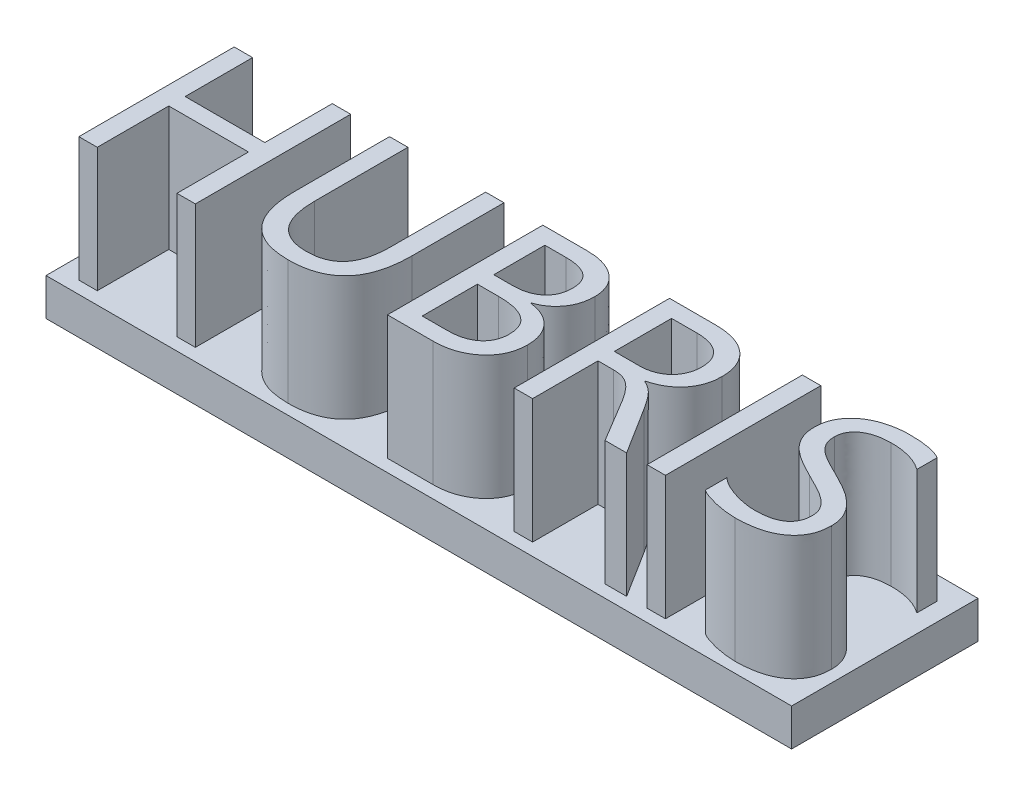
from build123d import *

# Parameters (mm, degrees)
SKETCH1_W           = 60
SKETCH1_H           = 15
BOSS_EXTRUDE1_DEPTH = 10
SKETCH2_W           = 1.480263158
SKETCH2_H           = 12.5
BOSS_EXTRUDE2_DEPTH = 10
SKETCH3_W           = 60
SKETCH3_H           = 15
CUT_EXTRUDE1_DEPTH  = 7


with BuildPart() as part:
    # Sketch1 → Boss-Extrude1 (new body)
    with BuildSketch(Plane(origin=(0, 0, 0), x_dir=(1, 0, 0), z_dir=(0, 1, 0))):
        Rectangle(SKETCH1_W, SKETCH1_H)
    extrude(amount=BOSS_EXTRUDE1_DEPTH)

    # Sketch2 → Boss-Extrude2 (add)
    # profile 1 of 6: a face of its own
    with BuildSketch(Plane(origin=(0, 10, 0), x_dir=(1, 0, 0), z_dir=(0, 1, 0))):
        Polygon((-18.980263158, -6.5), (-20.460526316, -6.5), (-20.460526316, -0.743421053), (-26.875, -0.743421053), (-26.875, -6.5), (-28.355263158, -6.5), (-28.355263158, 6), (-26.875, 6), (-26.875, 0.572368421), (-20.460526316, 0.572368421), (-20.460526316, 6), (-18.980263158, 6), align=None)
    # profile 2 of 6: a face of its own
    with BuildSketch(Plane(origin=(0, 10, 0), x_dir=(1, 0, 0), z_dir=(0, 1, 0))):
        with BuildLine():
            add(Edge.make_bspline(
                [(-6.644736842, -1.416735197), (-6.647662401, -1.628475672), (-6.653347072, -2.039909909), (-6.712175288, -2.635502205), (-6.799097733, -3.191168576), (-6.927496713, -3.705743773), (-7.094093187, -4.178825375), (-7.295069582, -4.613026174), (-7.533298394, -5.006461127), (-7.814589939, -5.354822739), (-8.126561468, -5.667677479), (-8.479356033, -5.935351244), (-8.867544713, -6.164331976), (-9.295579957, -6.344957328), (-9.757545703, -6.489758333), (-10.256136251, -6.590916958), (-10.790947414, -6.653723033), (-11.159870311, -6.660814598), (-11.350226151, -6.664473684)],
                knots=[0, 0, 0, 0, 1.257486394, 2.443429655, 3.551966457, 4.596153291, 5.589237736, 6.527229353, 7.434056241, 8.313863822, 9.181100807, 10.052374765, 10.937391783, 11.851514648, 12.805982722, 13.809031214, 14.869509843, 16, 16, 16, 16], degree=3))
            add(Edge.make_bspline(
                [(-11.350226151, -6.664473684), (-11.532006355, -6.660585737), (-11.885433594, -6.653026572), (-12.397812284, -6.592984237), (-12.876026498, -6.497443108), (-13.317940358, -6.358339799), (-13.724710413, -6.180085326), (-14.098333114, -5.964455082), (-14.434281149, -5.704232693), (-14.737439568, -5.408298765), (-15.00163825, -5.069268087), (-15.229994153, -4.691637024), (-15.42735099, -4.275761732), (-15.581646084, -3.817749807), (-15.704518822, -3.322590794), (-15.794658373, -2.78927663), (-15.844877572, -2.216090576), (-15.851726009, -1.821163422), (-15.855263158, -1.6171875)],
                knots=[0, 0, 0, 0, 1.124998465, 2.18728494, 3.188788596, 4.139710465, 5.0491097, 5.933139638, 6.802867158, 7.672820972, 8.549055192, 9.455775778, 10.399871767, 11.392647341, 12.442123967, 13.555388327, 14.737382537, 16, 16, 16, 16], degree=3))
            Line((-15.855263158, -1.6171875), (-15.855263158, 6))
            Line((-15.855263158, 6), (-14.375, 6))
            Line((-14.375, 6), (-14.375, -1.51953125))
            add(Edge.make_bspline(
                [(-14.375, -1.51953125), (-14.372310026, -1.673770728), (-14.36708679, -1.973263952), (-14.333274231, -2.408183666), (-14.266524904, -2.812631359), (-14.185617608, -3.189698078), (-14.071196546, -3.53488368), (-13.935126371, -3.851334232), (-13.774610552, -4.13843132), (-13.583105271, -4.391891537), (-13.374039595, -4.621088298), (-13.133787228, -4.814073864), (-12.872133683, -4.980425277), (-12.584985957, -5.117235859), (-12.271695909, -5.222460755), (-11.933871693, -5.296024601), (-11.571534778, -5.339884621), (-11.322082889, -5.345690581), (-11.193462171, -5.348684211)],
                knots=[0, 0, 0, 0, 1.299654722, 2.523593756, 3.671020551, 4.751360587, 5.769312404, 6.729351094, 7.65053966, 8.532525331, 9.400670288, 10.257368935, 11.120368259, 12.008152559, 12.930245471, 13.898631188, 14.916506242, 16, 16, 16, 16], degree=3))
            add(Edge.make_bspline(
                [(-11.193462171, -5.348684211), (-11.069169819, -5.345346138), (-10.828446729, -5.338881129), (-10.47831069, -5.299840696), (-10.154554344, -5.223679521), (-9.851863882, -5.124492426), (-9.574964016, -4.992599142), (-9.319031159, -4.836114888), (-9.091055132, -4.644641631), (-8.885155686, -4.427434656), (-8.706389582, -4.178054419), (-8.549018462, -3.90309122), (-8.418769419, -3.597168921), (-8.310780947, -3.263449887), (-8.22623267, -2.900734406), (-8.168919449, -2.508710158), (-8.132289603, -2.089029446), (-8.127479589, -1.799731148), (-8.125, -1.650596217)],
                knots=[0, 0, 0, 0, 1.085199783, 2.101759598, 3.068587945, 3.983717579, 4.876829924, 5.740014781, 6.594998481, 7.467846156, 8.345835695, 9.26684283, 10.228102979, 11.242570425, 12.325423214, 13.474977889, 14.698336626, 16, 16, 16, 16], degree=3))
            Line((-8.125, -1.650596217), (-8.125, 6))
            Line((-8.125, 6), (-6.644736842, 6))
            Line((-6.644736842, 6), (-6.644736842, -1.416735197))
        make_face()
    # profile 3 of 6: a face of its own
    with BuildSketch(Plane(origin=(0, 10, 0), x_dir=(1, 0, 0), z_dir=(0, 1, 0))):
        with BuildLine():
            Line((-3.519736842, -6.5), (-3.519736842, 6))
            Line((-3.519736842, 6), (0.034436678, 6))
            add(Edge.make_bspline(
                [(0.034436678, 6), (0.165561631, 5.997294329), (0.422319237, 5.991996316), (0.797354018, 5.957661301), (1.150871866, 5.891923868), (1.484228232, 5.805961321), (1.795381731, 5.69248087), (2.087260845, 5.55581981), (2.356421261, 5.391333888), (2.603817873, 5.202937209), (2.826824773, 4.996317211), (3.021752371, 4.771890401), (3.182811865, 4.530148777), (3.323300194, 4.277988492), (3.423595576, 4.005874795), (3.50011382, 3.720589466), (3.543276837, 3.419416968), (3.549479623, 3.2134987), (3.552631579, 3.10886102)],
                knots=[0, 0, 0, 0, 1.229187845, 2.406889916, 3.525113737, 4.596308509, 5.630135849, 6.625063885, 7.612446102, 8.580839693, 9.535318138, 10.457641659, 11.359607947, 12.254217275, 13.156433717, 14.069871481, 15.019202262, 16, 16, 16, 16], degree=3))
            add(Edge.make_bspline(
                [(3.552631579, 3.10886102), (3.551669824, 3.020532522), (3.549769093, 2.84596751), (3.519093927, 2.589481379), (3.477040745, 2.341719438), (3.414019381, 2.103090283), (3.335264554, 1.872413408), (3.237329482, 1.650503495), (3.120465111, 1.438676551), (2.987959319, 1.236168836), (2.837933766, 1.047288613), (2.678459973, 0.866770435), (2.501996844, 0.704391991), (2.312043414, 0.5556635), (2.108910139, 0.423645636), (1.894255398, 0.300116182), (1.663879941, 0.196023999), (1.503127001, 0.138667028), (1.422183388, 0.109786184)],
                knots=[0, 0, 0, 0, 1.073216213, 2.121014242, 3.136425385, 4.126687308, 5.118098756, 6.097345187, 7.07153834, 8.056583263, 9.035829693, 10.001972449, 10.98216001, 11.946785837, 12.93183076, 13.925264329, 14.955312402, 16, 16, 16, 16], degree=3))
            Line((1.422183388, 0.109786184), (1.422183388, 0.076377467))
            add(Edge.make_bspline(
                [(1.422183388, 0.076377467), (1.525323749, 0.062875582), (1.728044064, 0.036337896), (2.021120602, -0.035571512), (2.300121589, -0.121771391), (2.56290152, -0.229350778), (2.809012709, -0.359729174), (3.04075223, -0.507666599), (3.255173211, -0.679067543), (3.452266131, -0.86826338), (3.630842025, -1.075218467), (3.78815947, -1.296959775), (3.916262464, -1.537469562), (4.026430856, -1.789164381), (4.105982038, -2.058240946), (4.170977236, -2.340042366), (4.201684517, -2.63847796), (4.207543108, -2.84212763), (4.210526316, -2.94582648)],
                knots=[0, 0, 0, 0, 1.096402002, 2.154956183, 3.178015766, 4.174720488, 5.144733104, 6.112175251, 7.070332182, 8.035281626, 8.989853138, 9.94992532, 10.896034876, 11.859417808, 12.842597199, 13.851068742, 14.905759573, 16, 16, 16, 16], degree=3))
            add(Edge.make_bspline(
                [(4.210526316, -2.94582648), (4.207259903, -3.07537887), (4.20087031, -3.328802802), (4.145222963, -3.6991845), (4.056082616, -4.050157062), (3.92894504, -4.383359823), (3.763678932, -4.696411872), (3.564314683, -4.99318506), (3.326496341, -5.267648012), (3.05631246, -5.521689903), (2.7600373, -5.750990707), (2.442933713, -5.953997485), (2.103659797, -6.119779929), (1.748298448, -6.259782501), (1.373138854, -6.367975132), (0.979237433, -6.444108636), (0.565858792, -6.491686418), (0.283848648, -6.497189248), (0.139802632, -6.5)],
                knots=[0, 0, 0, 0, 1.026205522, 2.007412131, 2.960769465, 3.891227615, 4.826502666, 5.760421619, 6.718408566, 7.698110977, 8.694835934, 9.683599126, 10.676385999, 11.682407848, 12.707242684, 13.765703516, 14.85875911, 16, 16, 16, 16], degree=3))
            Line((0.139802632, -6.5), (-3.519736842, -6.5))
        make_face()
        with BuildLine():
            Line((-2.039473684, 4.684210526), (-2.039473684, 0.572368421))
            Line((-2.039473684, 0.572368421), (-0.528371711, 0.572368421))
            add(Edge.make_bspline(
                [(-0.528371711, 0.572368421), (-0.429807934, 0.574678498), (-0.238340149, 0.579166002), (0.041844566, 0.604304072), (0.306096871, 0.649431638), (0.553060074, 0.717276097), (0.783954422, 0.799226012), (0.999157898, 0.899309827), (1.197439387, 1.021109177), (1.379679881, 1.159052785), (1.543841301, 1.314105628), (1.684302291, 1.487204969), (1.807121121, 1.672970613), (1.905162003, 1.875244868), (1.979414536, 2.093050533), (2.032535706, 2.324733431), (2.067760622, 2.571536234), (2.070800785, 2.741236969), (2.072368421, 2.828741776)],
                knots=[0, 0, 0, 0, 1.212116198, 2.354629775, 3.456051241, 4.503724637, 5.499987713, 6.465998242, 7.416258802, 8.355892409, 9.272330463, 10.185432807, 11.091153343, 12.005105932, 12.941190166, 13.914695248, 14.924729524, 16, 16, 16, 16], degree=3))
            add(Edge.make_bspline(
                [(2.072368421, 2.828741776), (2.07031428, 2.903365358), (2.066308771, 3.048878948), (2.037606369, 3.259707562), (1.99217546, 3.457487761), (1.92502222, 3.6401622), (1.840057104, 3.808664546), (1.735869195, 3.96267361), (1.612095454, 4.101549047), (1.469487934, 4.225618075), (1.308426952, 4.334927584), (1.127032884, 4.426272806), (0.927656235, 4.506438476), (0.709342194, 4.572893608), (0.472053627, 4.623825744), (0.216960298, 4.659385695), (-0.056898958, 4.679476689), (-0.24564933, 4.682596065), (-0.343338816, 4.684210526)],
                knots=[0, 0, 0, 0, 1.029959442, 2.008387857, 2.93203746, 3.826220497, 4.688311486, 5.531290821, 6.385722972, 7.24902983, 8.134647622, 9.065536915, 10.047176225, 11.098371407, 12.211786757, 13.394221485, 14.651355428, 16, 16, 16, 16], degree=3))
            Line((-0.343338816, 4.684210526), (-2.039473684, 4.684210526))
        make_face(mode=Mode.SUBTRACT)
        with BuildLine():
            Line((-2.039473684, -0.743421053), (-2.039473684, -5.184210526))
            Line((-2.039473684, -5.184210526), (-0.022101151, -5.184210526))
            add(Edge.make_bspline(
                [(-0.022101151, -5.184210526), (0.084191924, -5.182168776), (0.291167566, -5.178193046), (0.591626002, -5.149443895), (0.874718736, -5.104455476), (1.137834324, -5.036578546), (1.385723534, -4.95651728), (1.610662888, -4.849617152), (1.820051754, -4.728350229), (2.009104885, -4.58714366), (2.17988846, -4.43052004), (2.327997052, -4.257285856), (2.449947884, -4.06833016), (2.556159648, -3.869611067), (2.631949355, -3.653273272), (2.687796225, -3.424315878), (2.726101271, -3.181811647), (2.728856728, -3.01536443), (2.730263158, -2.930407072)],
                knots=[0, 0, 0, 0, 1.267073876, 2.467267316, 3.595563973, 4.680502649, 5.704304317, 6.695809729, 7.643422191, 8.585071989, 9.502938344, 10.401336336, 11.293618148, 12.179800421, 13.081154153, 14.017471929, 14.988085533, 16, 16, 16, 16], degree=3))
            add(Edge.make_bspline(
                [(2.730263158, -2.930407072), (2.727783884, -2.842040293), (2.722972135, -2.670538943), (2.686081899, -2.421644899), (2.627749279, -2.189587829), (2.545241592, -1.973194851), (2.436620451, -1.774828417), (2.304704446, -1.592391296), (2.146295682, -1.429963522), (1.964137739, -1.285534756), (1.760387838, -1.15628075), (1.531391838, -1.045946553), (1.279503101, -0.951101762), (1.003352098, -0.874405355), (0.703284635, -0.816300736), (0.379868587, -0.772749945), (0.032288739, -0.746973316), (-0.20708973, -0.744629361), (-0.330489309, -0.743421053)],
                knots=[0, 0, 0, 0, 0.990506213, 1.922364421, 2.814619668, 3.669055511, 4.511529967, 5.343424861, 6.185735034, 7.046785963, 7.944813049, 8.885588764, 9.891759231, 10.959153265, 12.095053295, 13.316281231, 14.616543222, 16, 16, 16, 16], degree=3))
            Line((-0.330489309, -0.743421053), (-2.039473684, -0.743421053))
        make_face(mode=Mode.SUBTRACT)
    # profile 4 of 6: a face of its own
    with BuildSketch(Plane(origin=(0, 10, 0), x_dir=(1, 0, 0), z_dir=(0, 1, 0))):
        with BuildLine():
            Line((15.723684211, -6.5), (13.989000822, -6.5))
            Line((13.989000822, -6.5), (11.907380757, -3.030633224))
            add(Edge.make_bspline(
                [(11.907380757, -3.030633224), (11.812848161, -2.8800228), (11.635024684, -2.596712381), (11.349235774, -2.219049075), (11.072700879, -1.899185876), (10.780704533, -1.648805831), (10.475848596, -1.453051883), (10.142128043, -1.326950544), (9.777938279, -1.249788142), (9.522939955, -1.241303048), (9.388877467, -1.236842105)],
                knots=[0, 0, 0, 0, 1.306497362, 2.457627467, 3.478958043, 4.407874435, 5.276294006, 6.127627337, 7.015621229, 8, 8, 8, 8], degree=3))
            Line((9.388877467, -1.236842105), (8.157894737, -1.236842105))
            Line((8.157894737, -1.236842105), (8.157894737, -6.5))
            Line((8.157894737, -6.5), (6.677631579, -6.5))
            Line((6.677631579, -6.5), (6.677631579, 6))
            Line((6.677631579, 6), (10.424547697, 6))
            add(Edge.make_bspline(
                [(10.424547697, 6), (10.559121493, 5.997545168), (10.82369727, 5.992718901), (11.213069769, 5.954276258), (11.585444226, 5.88668285), (11.941506673, 5.79744372), (12.27891147, 5.683304114), (12.593367105, 5.538266832), (12.88648782, 5.368786699), (13.154119171, 5.169142131), (13.399863063, 4.946979477), (13.614858261, 4.693687832), (13.802540133, 4.416545938), (13.960365058, 4.113065371), (14.087078766, 3.784086917), (14.17994269, 3.427527038), (14.233609026, 3.042822918), (14.240089807, 2.777513243), (14.243421053, 2.64113898)],
                knots=[0, 0, 0, 0, 1.122660118, 2.207180616, 3.260035189, 4.277559223, 5.267526261, 6.226939943, 7.162224589, 8.087074141, 9.00774428, 9.920166118, 10.85183919, 11.794874382, 12.767769948, 13.787074559, 14.862513871, 16, 16, 16, 16], degree=3))
            add(Edge.make_bspline(
                [(14.243421053, 2.64113898), (14.240812811, 2.533961899), (14.235685688, 2.323279733), (14.199417256, 2.013627125), (14.138228433, 1.716671898), (14.050019974, 1.434374365), (13.942201939, 1.165970553), (13.813007876, 0.911813898), (13.661045551, 0.673025801), (13.489217645, 0.44915936), (13.296454565, 0.242977767), (13.089217459, 0.048446611), (12.858623785, -0.125516972), (12.611328474, -0.28544598), (12.347342385, -0.428398015), (12.067797045, -0.555678585), (11.771762691, -0.663260081), (11.566826707, -0.721542697), (11.462787829, -0.751130757)],
                knots=[0, 0, 0, 0, 1.081472828, 2.125893282, 3.141472299, 4.136796786, 5.106410527, 6.057503338, 7.009617098, 7.958900923, 8.9009934, 9.855302418, 10.823566394, 11.811505165, 12.825021642, 13.850268175, 14.908655843, 16, 16, 16, 16], degree=3))
            Line((11.462787829, -0.751130757), (11.462787829, -0.787109375))
            add(Edge.make_bspline(
                [(11.462787829, -0.787109375), (11.566162208, -0.834122488), (11.763326659, -0.923789914), (12.029145985, -1.097811175), (12.27042499, -1.291578911), (12.48964897, -1.523105762), (12.71109869, -1.779602353), (12.923028844, -2.079649132), (13.152215563, -2.414873594), (13.307646294, -2.654212032), (13.390213816, -2.781352796)],
                knots=[0, 0, 0, 0, 0.964360555, 1.839310864, 2.693732611, 3.590073818, 4.546144586, 5.573387662, 6.710941094, 8, 8, 8, 8], degree=3))
            Line((13.390213816, -2.781352796), (15.723684211, -6.5))
        make_face()
        with BuildLine():
            Line((8.157894737, 4.684210526), (8.157894737, 0.078947368))
            Line((8.157894737, 0.078947368), (10.177837171, 0.078947368))
            add(Edge.make_bspline(
                [(10.177837171, 0.078947368), (10.268705732, 0.080984538), (10.4484051, 0.085013192), (10.712827515, 0.115055347), (10.965606309, 0.171091727), (11.208755247, 0.240573595), (11.435930575, 0.337668564), (11.652040566, 0.446839852), (11.848748156, 0.578956674), (12.031878696, 0.725408753), (12.193210353, 0.894907739), (12.340902908, 1.077923175), (12.463792249, 1.282695831), (12.573767647, 1.500267519), (12.656970566, 1.737244432), (12.719496499, 1.987415669), (12.755400242, 2.251192258), (12.760538092, 2.431158368), (12.763157895, 2.52292352)],
                knots=[0, 0, 0, 0, 1.090010243, 2.155576699, 3.185466336, 4.1933334, 5.183762916, 6.144316812, 7.093369302, 8.020984545, 8.951157476, 9.894798401, 10.83591824, 11.810170468, 12.814521676, 13.841330878, 14.899289422, 16, 16, 16, 16], degree=3))
            add(Edge.make_bspline(
                [(12.763157895, 2.52292352), (12.761287915, 2.605263554), (12.757631554, 2.766262529), (12.726013385, 3.0011874), (12.675459527, 3.222722214), (12.603235198, 3.429660699), (12.510335105, 3.622750765), (12.393057208, 3.799559289), (12.259697295, 3.96571342), (12.104102267, 4.11571668), (11.9285718, 4.247919957), (11.737882231, 4.368974616), (11.525257363, 4.465356199), (11.294398561, 4.544762257), (11.046371223, 4.609671232), (10.778549432, 4.651205782), (10.493778304, 4.681625589), (10.296999251, 4.683332783), (10.19582648, 4.684210526)],
                knots=[0, 0, 0, 0, 1.036630811, 2.02691802, 2.979521427, 3.89397019, 4.781810153, 5.670567375, 6.560240909, 7.460578941, 8.384147086, 9.324204361, 10.29927051, 11.31606129, 12.396781476, 13.52306989, 14.726501219, 16, 16, 16, 16], degree=3))
            Line((10.19582648, 4.684210526), (8.157894737, 4.684210526))
        make_face(mode=Mode.SUBTRACT)
    # profile 5 of 6: a face of its own
    with BuildSketch(Plane(origin=(0, 10, 0), x_dir=(1, 0, 0), z_dir=(0, 1, 0))):
        with Locations((18.108552632, -0.25)):
            Rectangle(SKETCH2_W, SKETCH2_H)
    # profile 6 of 6: a face of its own
    with BuildSketch(Plane(origin=(0, 10, 0), x_dir=(1, 0, 0), z_dir=(0, 1, 0))):
        with BuildLine():
            Line((21.480263158, -5.9140625), (21.480263158, -4.197368421))
            add(Edge.make_bspline(
                [(21.480263158, -4.197368421), (21.587853422, -4.285047545), (21.81141042, -4.467232074), (22.198180099, -4.691326799), (22.624075892, -4.881759132), (23.072292509, -5.046418018), (23.533176417, -5.176078056), (23.992354377, -5.272880538), (24.435715534, -5.33470136), (24.72416168, -5.344157262), (24.862253289, -5.348684211)],
                knots=[0, 0, 0, 0, 0.915004429, 1.901246785, 2.938742273, 3.992384141, 5.050265912, 6.096049217, 7.088496653, 8, 8, 8, 8], degree=3))
            add(Edge.make_bspline(
                [(24.862253289, -5.348684211), (24.971945669, -5.347293338), (25.184735165, -5.344595221), (25.492778217, -5.32136721), (25.779565449, -5.283453505), (26.044886099, -5.229471366), (26.2900974, -5.162115895), (26.511700284, -5.072922964), (26.71368369, -4.974278605), (26.893154295, -4.857619581), (27.050153513, -4.724875473), (27.191509928, -4.581958871), (27.305817247, -4.420726121), (27.404207968, -4.24984785), (27.47454296, -4.06173165), (27.529320367, -3.862483366), (27.560216199, -3.648363691), (27.5638943, -3.501876738), (27.565789474, -3.426398026)],
                knots=[0, 0, 0, 0, 1.398434843, 2.712788668, 3.93618073, 5.084318901, 6.163028125, 7.173087404, 8.125582231, 9.025328272, 9.893769159, 10.743463012, 11.58021176, 12.406631653, 13.250408149, 14.13268173, 15.037847578, 16, 16, 16, 16], degree=3))
            add(Edge.make_bspline(
                [(27.565789474, -3.426398026), (27.563879454, -3.345643671), (27.560130917, -3.187157974), (27.514554825, -2.95932464), (27.445673552, -2.745509662), (27.343106955, -2.550136687), (27.21768834, -2.366567794), (27.073793596, -2.19133964), (26.90749056, -2.025434594), (26.649062434, -1.812774399), (26.277440998, -1.555610581), (25.768741089, -1.274749325), (25.207241919, -0.988106847), (24.816996328, -0.792829561), (24.615542763, -0.692023026)],
                knots=[0, 0, 0, 0, 0.682239313, 1.338939215, 1.957751799, 2.57686141, 3.198003949, 3.836452982, 4.492432598, 5.181909407, 6.665690205, 8.308087733, 10.094151719, 12, 12, 12, 12], degree=3))
            add(Edge.make_bspline(
                [(24.615542763, -0.692023026), (24.40256349, -0.582557741), (23.986969892, -0.368954459), (23.481670226, -0.090709185), (23.106085466, 0.143114204), (22.848208979, 0.327508769), (22.606548546, 0.516134008), (22.383685651, 0.714764478), (22.182015145, 0.924417791), (22.006447929, 1.151724326), (21.849595015, 1.388544401), (21.715920003, 1.641635762), (21.609298038, 1.912580461), (21.536117559, 2.206322099), (21.488310525, 2.520504584), (21.482993289, 2.737754289), (21.480263158, 2.849300987)],
                knots=[0, 0, 0, 0, 1.998719085, 3.900167594, 4.812672151, 5.689550844, 6.544915547, 7.370259114, 8.17943293, 8.968940773, 9.764158424, 10.54771916, 11.353664497, 12.187787742, 13.069520983, 14, 14, 14, 14], degree=3))
            add(Edge.make_bspline(
                [(21.480263158, 2.849300987), (21.48408793, 2.986745368), (21.491531145, 3.254219663), (21.56712049, 3.639810059), (21.680312801, 3.999656695), (21.848825607, 4.32746803), (22.052151625, 4.628347196), (22.287480929, 4.901806723), (22.551293447, 5.148478036), (22.846222749, 5.363912583), (23.166090787, 5.552557781), (23.504558852, 5.722087922), (23.867715423, 5.856091293), (24.246120433, 5.969505124), (24.638284211, 6.054717286), (25.03600402, 6.120690888), (25.43897039, 6.156256064), (25.70854589, 6.161726064), (25.843955592, 6.164473684)],
                knots=[0, 0, 0, 0, 1.074993019, 2.091995313, 3.065687399, 4.019677666, 4.966684968, 5.90382871, 6.838857327, 7.788758724, 8.757423565, 9.744426852, 10.748605348, 11.784350249, 12.835726258, 13.888919686, 14.939589261, 16, 16, 16, 16], degree=3))
            add(Edge.make_bspline(
                [(25.843955592, 6.164473684), (25.993897112, 6.163107518), (26.282835253, 6.16047491), (26.700423327, 6.13726239), (27.086329394, 6.099159045), (27.442086919, 6.047059888), (27.765235446, 5.974368989), (28.058389751, 5.89132843), (28.319166442, 5.789307766), (28.477058642, 5.705855914), (28.552631579, 5.665912829)],
                knots=[0, 0, 0, 0, 1.293172397, 2.491950391, 3.605748607, 4.63709553, 5.590752243, 6.460523097, 7.263150489, 8, 8, 8, 8], degree=3))
            Line((28.552631579, 5.665912829), (28.552631579, 4.026315789))
            add(Edge.make_bspline(
                [(28.552631579, 4.026315789), (28.457044413, 4.092504835), (28.264651439, 4.225726771), (27.951116016, 4.391670046), (27.618486184, 4.533684408), (27.265693797, 4.648671081), (26.893685563, 4.73896439), (26.50190751, 4.802379432), (26.089761149, 4.841742148), (25.808067708, 4.846335852), (25.6640625, 4.848684211)],
                knots=[0, 0, 0, 0, 0.912969237, 1.837577921, 2.781586781, 3.752291347, 4.749863021, 5.786812914, 6.868591096, 8, 8, 8, 8], degree=3))
            add(Edge.make_bspline(
                [(25.6640625, 4.848684211), (25.501092428, 4.843251478), (25.173492765, 4.832330692), (24.76783681, 4.771296079), (24.453318615, 4.692363089), (24.227901928, 4.621830271), (24.016906955, 4.530876667), (23.818745589, 4.425926133), (23.635624714, 4.306363219), (23.472448148, 4.167655097), (23.324288195, 4.015852456), (23.195234028, 3.845806463), (23.087895983, 3.657862066), (23.013008221, 3.44842407), (22.969235717, 3.219477485), (22.963496986, 3.06023064), (22.960526316, 2.977796053)],
                knots=[0, 0, 0, 0, 1.860074881, 3.739090831, 4.666194798, 5.559700613, 6.431331058, 7.284172844, 8.116597904, 8.9214701, 9.723487286, 10.532977397, 11.351508434, 12.183416655, 13.059640417, 14, 14, 14, 14], degree=3))
            add(Edge.make_bspline(
                [(22.960526316, 2.977796053), (22.961785904, 2.901351888), (22.964235555, 2.752682969), (23.003727787, 2.538907585), (23.054687644, 2.338010962), (23.136422316, 2.153509199), (23.241403557, 1.982457121), (23.36549116, 1.819773854), (23.510357718, 1.665101132), (23.738421507, 1.463589248), (24.079523521, 1.226318321), (24.458969848, 1.003825263), (24.801948548, 0.828679552), (25.083227706, 0.684529636), (25.38520689, 0.535468935), (25.59291342, 0.43434954), (25.700041118, 0.382195724)],
                knots=[0, 0, 0, 0, 0.799050094, 1.553995843, 2.269835135, 2.964689535, 3.656876093, 4.36724421, 5.103361224, 5.872034384, 7.549627965, 9.443199644, 10.474170845, 11.581256692, 12.752497547, 14, 14, 14, 14], degree=3))
            add(Edge.make_bspline(
                [(25.700041118, 0.382195724), (25.921468926, 0.272356549), (26.357788275, 0.055920512), (26.879890757, -0.246517675), (27.28039311, -0.490937431), (27.554362981, -0.69083913), (27.812749704, -0.896174663), (28.052206709, -1.110854465), (28.269001676, -1.338901186), (28.466294777, -1.575905208), (28.631815596, -1.831062163), (28.781530119, -2.092953668), (28.901559359, -2.373148427), (28.986332272, -2.672677234), (29.035060045, -2.992208742), (29.042324706, -3.211216289), (29.046052632, -3.323601974)],
                knots=[0, 0, 0, 0, 1.961241859, 3.864590368, 4.787073623, 5.683352764, 6.554046293, 7.406090961, 8.233221871, 9.049806693, 9.849344089, 10.643777385, 11.441897032, 12.26187136, 13.108063723, 14, 14, 14, 14], degree=3))
            add(Edge.make_bspline(
                [(29.046052632, -3.323601974), (29.041726869, -3.471209325), (29.033379501, -3.756045336), (28.966322259, -4.165599965), (28.853974709, -4.54078107), (28.69223003, -4.878715579), (28.495660769, -5.184949615), (28.264357901, -5.458788299), (28.003970381, -5.704920067), (27.710868029, -5.918371001), (27.391533195, -6.103006971), (27.046919769, -6.260145848), (26.679811989, -6.390853163), (26.290885362, -6.492919569), (25.885882971, -6.567779895), (25.46921744, -6.625059689), (25.041012539, -6.659272457), (24.751809091, -6.662724471), (24.605263158, -6.664473684)],
                knots=[0, 0, 0, 0, 1.12705684, 2.174867115, 3.160167289, 4.108552964, 5.027005581, 5.932711888, 6.840047824, 7.757520857, 8.695806774, 9.653291768, 10.646771719, 11.668951898, 12.721329239, 13.791139783, 14.880720528, 16, 16, 16, 16], degree=3))
            add(Edge.make_bspline(
                [(24.605263158, -6.664473684), (24.552991958, -6.664111565), (24.44235834, -6.663345129), (24.268464296, -6.65167105), (24.07659163, -6.636021827), (23.795706192, -6.609496105), (23.4291086, -6.556446631), (22.986274127, -6.473254335), (22.549802591, -6.367161045), (22.200743279, -6.257482136), (21.940047502, -6.163259264), (21.768431136, -6.084007996), (21.615021327, -6.004780061), (21.523462814, -5.943143983), (21.480263158, -5.9140625)],
                knots=[0, 0, 0, 0, 0.579324612, 1.226158531, 1.931157366, 2.713513896, 4.353219073, 6.034949729, 7.707001279, 9.328818881, 10.089020747, 10.777453419, 11.423171144, 12, 12, 12, 12], degree=3))
        make_face()
    extrude(amount=BOSS_EXTRUDE2_DEPTH)

    # Sketch3 → Cut-Extrude1 (cut)
    with BuildSketch(Plane.XZ):
        Rectangle(SKETCH3_W, SKETCH3_H)
    extrude(amount=-CUT_EXTRUDE1_DEPTH, mode=Mode.SUBTRACT)


solid = part.part
